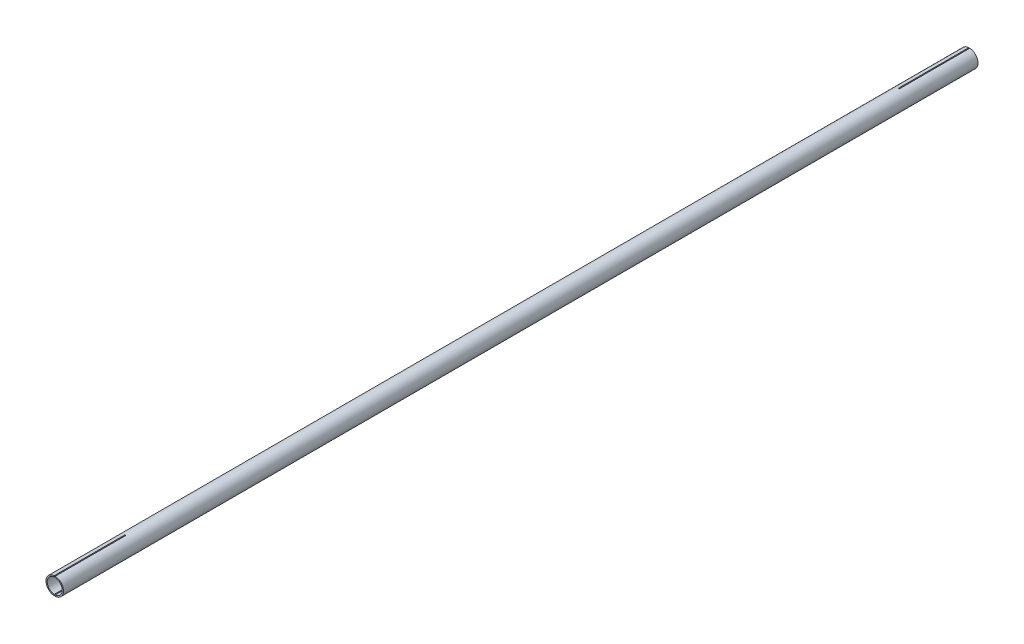
from build123d import *

# Parameters (mm, degrees)
SKETCH1_R           = 17.46
SKETCH1_R_2         = 15
BOSS_EXTRUDE1_DEPTH = 1828.8
SKETCH4_W           = 2.08
SKETCH4_H           = 50
CUT_EXTRUDE2_DEPTH  = 141
SKETCH7_W           = 2.08
SKETCH7_H           = 50
CUT_EXTRUDE3_DEPTH  = 141


with BuildPart() as part:
    # Sketch1 → Boss-Extrude1 (new body)
    with BuildSketch(Plane.XY):
        Circle(SKETCH1_R)
        Circle(SKETCH1_R_2, mode=Mode.SUBTRACT)
    extrude(amount=BOSS_EXTRUDE1_DEPTH)

    # Sketch4 → Cut-Extrude2 (cut)
    with BuildSketch(Plane.XY):
        Rectangle(SKETCH4_W, SKETCH4_H)
    extrude(amount=CUT_EXTRUDE2_DEPTH, mode=Mode.SUBTRACT)

    # Sketch7 → Cut-Extrude3 (cut)
    with BuildSketch(Plane.XY.offset(1828.8)):
        Rectangle(SKETCH7_W, SKETCH7_H)
    extrude(amount=-CUT_EXTRUDE3_DEPTH, mode=Mode.SUBTRACT)


solid = part.part
